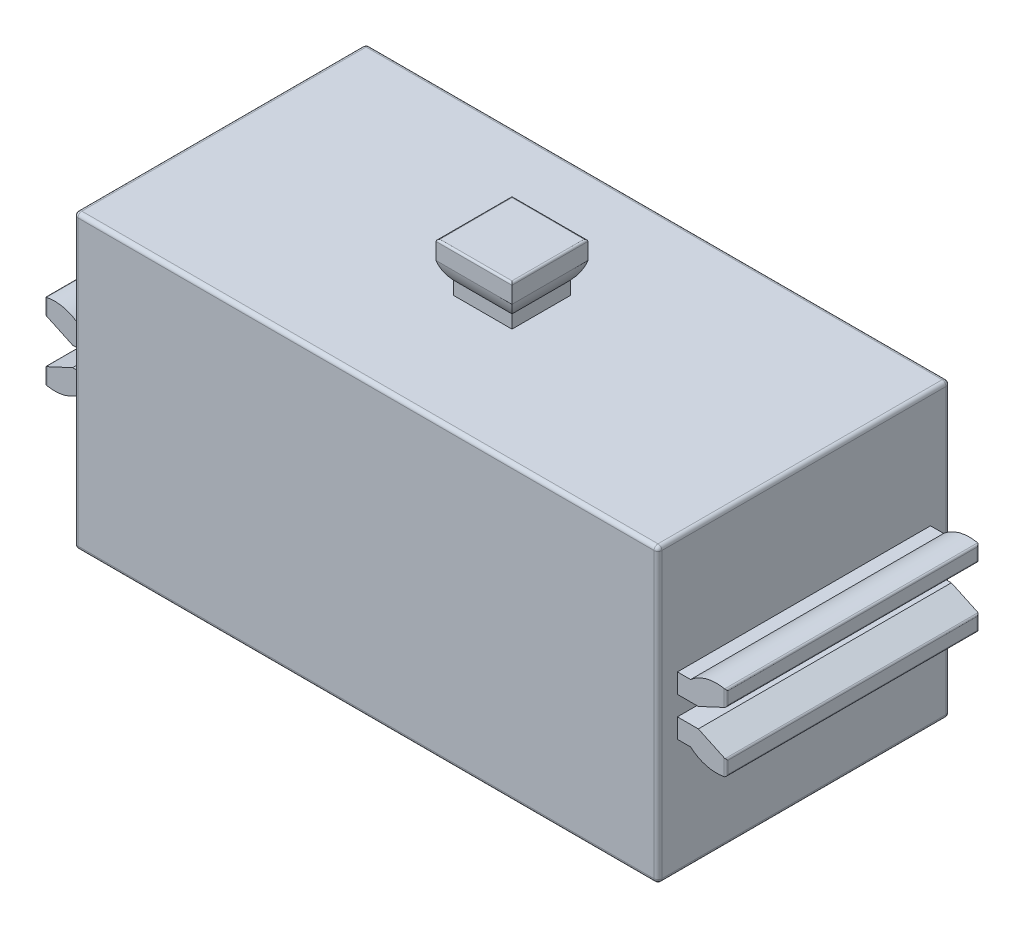
from build123d import *

# Parameters (mm, degrees)
EXTRUDE_1_DEPTH      = 7.5
EXTRUDE_1_DEPTH_BACK = 7.5
SKETCH_1_W           = 30
SKETCH_1_H           = 15
EXTRUDE_START        = -1
EXTRUDE_2_DEPTH      = 13
SKETCH_3_W           = 3
SKETCH_3_H           = 3
EXTRUDE_3_DEPTH      = 1
EXTRUDE_4_DEPTH      = 2
EXTRUDE_4_DEPTH_BACK = 3
CUT_EXTRUDE_1_REACH  = 25.12
SKETCH_6_R           = 2.25
CUT_EXTRUDE_2_DEPTH  = 2
SKETCH_10_W          = 3.5
SKETCH_10_H          = 3.793222558
CUT_EXTRUDE_3_DEPTH  = 1
FILLET_1_R           = 0.1
FILLET_2_R           = 0.2


with BuildPart() as part:
    # 草图1 → 凸台-拉伸1 (new, two sides: drawn at the far end of the back side and taken through both)
    with BuildSketch(Plane.XY.offset(-EXTRUDE_1_DEPTH_BACK)):
        Rectangle(SKETCH_1_W, SKETCH_1_H)
    extrude(amount=EXTRUDE_1_DEPTH + EXTRUDE_1_DEPTH_BACK)

    # 草图2 → 凸台-拉伸2 (add)
    with BuildSketch(Plane.XY.offset(7.5).offset(EXTRUDE_START)):
        with BuildLine():
            Line((-15.677124344, 1.5), (-15, 1.5))
            Line((-15, 1.5), (-15, 0.5))
            Line((-15, 0.5), (-16.07225346, 0.5))
            Line((-16.07225346, 0.5), (-17.5, 1.165769145))
            Line((-17.5, 1.165769145), (-17.5, 1.936491673))
            ThreePointArc((-17.5, 1.936491673), (-16.53426152, 1.94501611), (-15.677124344, 1.5))
        make_face()
        with BuildLine():
            Line((-15.677124344, -1.5), (-15, -1.5))
            Line((-15, -1.5), (-15, -0.5))
            Line((-15, -0.5), (-16.07225346, -0.5))
            Line((-16.07225346, -0.5), (-17.5, -1.165769145))
            Line((-17.5, -1.165769145), (-17.5, -1.936491673))
            ThreePointArc((-17.5, -1.936491673), (-16.53426152, -1.94501611), (-15.677124344, -1.5))
        make_face()
        with BuildLine():
            Line((15, -0.5), (15, -1.5))
            Line((15, -1.5), (15.677124344, -1.5))
            ThreePointArc((15.677124344, -1.5), (16.53426152, -1.94501611), (17.5, -1.936491673))
            Line((17.5, -1.936491673), (17.5, -1.165769145))
            Line((17.5, -1.165769145), (16.07225346, -0.5))
            Line((16.07225346, -0.5), (15, -0.5))
        make_face()
        with BuildLine():
            Line((15, 0.5), (16.07225346, 0.5))
            Line((16.07225346, 0.5), (17.5, 1.165769145))
            Line((17.5, 1.165769145), (17.5, 1.936491673))
            ThreePointArc((17.5, 1.936491673), (16.53426152, 1.94501611), (15.677124344, 1.5))
            Line((15.677124344, 1.5), (15, 1.5))
            Line((15, 1.5), (15, 0.5))
        make_face()
    extrude(amount=-EXTRUDE_2_DEPTH)

    # 草图3 → 凸台-拉伸3 (add)
    with BuildSketch(Plane(origin=(0, 7.5, 0), x_dir=(-1, 0, 0), z_dir=(0, 1, 0))):
        Rectangle(SKETCH_3_W, SKETCH_3_H)
    extrude(amount=EXTRUDE_3_DEPTH)

    # 草图4 → 凸台-拉伸4 (add, two sides: drawn at the far end of the back side and taken through both)
    with BuildSketch(Plane.XY.offset(-EXTRUDE_4_DEPTH_BACK)):
        with BuildLine():
            Line((-1.95, 10), (1.95, 10))
            Line((1.95, 10), (1.95, 9.055590279))
            ThreePointArc((1.95, 9.055590279), (1.780042303, 8.588161527), (1.5, 8.177124344))
            Line((1.5, 8.177124344), (-1.5, 8.177124344))
            ThreePointArc((-1.5, 8.177124344), (-1.780042303, 8.588161527), (-1.95, 9.055590279))
            Line((-1.95, 9.055590279), (-1.95, 10))
        make_face()
    extrude(amount=EXTRUDE_4_DEPTH + EXTRUDE_4_DEPTH_BACK)

    # 草图5 → 切除-拉伸1 (cut, up to next)
    with BuildSketch(Plane(origin=(1.95, 0, 0), x_dir=(0, 0, -1), z_dir=(1, 0, 0)), mode=Mode.PRIVATE) as cut_extrude_1_sk1:
        with BuildLine():
            Line((-1.95, 10), (-1.95, 9.055590279))
            ThreePointArc((-1.95, 9.055590279), (-1.780042303, 8.588161527), (-1.5, 8.177124344))
            Line((-1.5, 8.177124344), (-2, 8.177124344))
            Line((-2, 8.177124344), (-2, 10))
            Line((-2, 10), (-1.95, 10))
        make_face()
    cut_extrude_1_tool1 = extrude(cut_extrude_1_sk1.sketch, amount=-CUT_EXTRUDE_1_REACH, mode=Mode.PRIVATE) & part.part
    # 草图5 → 切除-拉伸1 (cut, up to next)
    with BuildSketch(Plane(origin=(1.95, 0, 0), x_dir=(0, 0, -1), z_dir=(1, 0, 0)), mode=Mode.PRIVATE) as cut_extrude_1_sk2:
        with BuildLine():
            Line((3, 10), (3, 8.177124344))
            Line((3, 8.177124344), (1.5, 8.177124344))
            ThreePointArc((1.5, 8.177124344), (1.780042303, 8.588161527), (1.95, 9.055590279))
            Line((1.95, 9.055590279), (1.95, 10))
            Line((1.95, 10), (3, 10))
        make_face()
    cut_extrude_1_tool2 = extrude(cut_extrude_1_sk2.sketch, amount=-CUT_EXTRUDE_1_REACH, mode=Mode.PRIVATE) & part.part
    add(cut_extrude_1_tool1.solids().sort_by_distance((1.95, 8.675075, 1.873038))[0], mode=Mode.SUBTRACT)
    add(cut_extrude_1_tool2.solids().sort_by_distance((1.95, 9.039049, -2.424924))[0], mode=Mode.SUBTRACT)

    # 草图6 → 切除-拉伸2 (cut)
    with BuildSketch(Plane.XZ.offset(7.5)):
        with Locations((-5, 4)):
            Circle(SKETCH_6_R)
        with Locations((5, 4)):
            Circle(SKETCH_6_R)
    extrude(amount=-CUT_EXTRUDE_2_DEPTH, mode=Mode.SUBTRACT)

    # 草图10 → 切除-拉伸3 (cut)
    with BuildSketch(Plane.XZ.offset(7.5)):
        with Locations((-5, -3.896611279)):
            Rectangle(SKETCH_10_W, SKETCH_10_H)
        with Locations((5, -3.896611279)):
            Rectangle(SKETCH_10_W, SKETCH_10_H)
    extrude(amount=-CUT_EXTRUDE_3_DEPTH, mode=Mode.SUBTRACT)

    # 草图11 → 旋转3 (revolve)
    with BuildSketch(Plane.XZ.offset(6.5)):
        with BuildLine():
            Line((-5, -3.25), (-5, -4.75))
            ThreePointArc((-5, -4.75), (-4.25, -4), (-5, -3.25))
        make_face()
    revolve(axis=Axis((-5, -6.5, -3.25), (0, 0, -1)))

    # 草图12 → 旋转4 (revolve)
    with BuildSketch(Plane.XZ.offset(6.5)):
        with BuildLine():
            Line((5, -3.25), (5, -4.75))
            ThreePointArc((5, -4.75), (5.75, -4), (5, -3.25))
        make_face()
    revolve(axis=Axis((5, -6.5, -3.25), (0, 0, -1)))

    # 圆角1
    fillet_1_edges = [part.edges().sort_by_distance(p)[0] for p in [
        (1.95, 10, 0),
        (0, 10, 1.95),
        (-1.95, 10, 0),
        (0, 10, -1.95),
        (-17.5, -1.936491673, 0),
        (-17.5, -1.551130409, -6.5),
        (-17.5, -1.165769145, 0),
        (-17.5, -1.551130409, 6.5),
        (-17.5, 1.165769145, 0),
        (-17.5, 1.551130409, -6.5),
        (-17.5, 1.936491673, 0),
        (-17.5, 1.551130409, 6.5),
        (17.5, -1.165769145, 0),
        (17.5, -1.551130409, -6.5),
        (17.5, -1.936491673, 0),
        (17.5, -1.551130409, 6.5),
        (17.5, 1.936491673, 0),
        (17.5, 1.551130409, -6.5),
        (17.5, 1.165769145, 0),
        (17.5, 1.551130409, 6.5),
    ]]
    fillet(fillet_1_edges, radius=FILLET_1_R)

    # 圆角2
    fillet_2_edges = [part.edges().sort_by_distance(p)[0] for p in [
        (0, -7.5, -7.5),
        (15, 0, -7.5),
        (0, 7.5, -7.5),
        (-15, 0, -7.5),
        (0, 7.5, 7.5),
        (15, 0, 7.5),
        (0, -7.5, 7.5),
        (-15, 0, 7.5),
        (-15, -7.5, 0),
        (-15, 7.5, 0),
        (15, 7.5, 0),
        (15, -7.5, 0),
    ]]
    fillet(fillet_2_edges, radius=FILLET_2_R)


with BuildPart() as body_2:
    # 草图7 → 旋转1 (revolve)
    with BuildSketch(Plane.XZ.offset(7.5)):
        with BuildLine():
            Line((-5, 6), (-5, 2))
            ThreePointArc((-5, 2), (-3, 4), (-5, 6))
        make_face()
    revolve(axis=Axis((-5, -7.5, 6), (0, 0, -1)))


with BuildPart() as body_3:
    # 草图8 → 旋转2 (revolve)
    with BuildSketch(Plane.XZ.offset(7.5)):
        with BuildLine():
            Line((5, 6), (5, 2))
            ThreePointArc((5, 2), (7, 4), (5, 6))
        make_face()
    revolve(axis=Axis((5, -7.5, 6), (0, 0, -1)))


solid = Compound([part.part, body_2.part, body_3.part])
